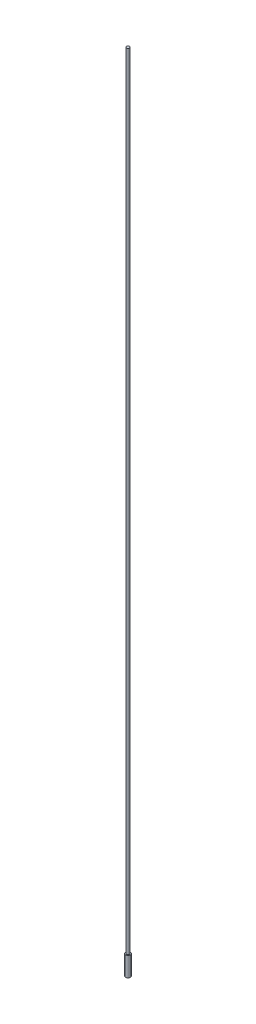
from build123d import *

# Parameters (mm, degrees)
SKETCH1_R           = 1.25
BOSS_EXTRUDE1_DEPTH = 701.675
SKETCH2_R           = 2.1
BOSS_EXTRUDE2_DEPTH = 17


with BuildPart() as part:
    # Sketch1 → Boss-Extrude1 (new body)
    with BuildSketch(Plane(origin=(0, 0, 0), x_dir=(1, 0, 0), z_dir=(0, 1, 0))):
        with Locations(Location((0, 0, 0), (0, 0, 270))):
            Circle(SKETCH1_R)
    extrude(amount=BOSS_EXTRUDE1_DEPTH)

    # Sketch2 → Boss-Extrude2 (add)
    with BuildSketch(Plane.XZ):
        with Locations(Location((0, 0, 0), (0, 0, 270))):
            Circle(SKETCH2_R)
    extrude(amount=-BOSS_EXTRUDE2_DEPTH)


solid = part.part
